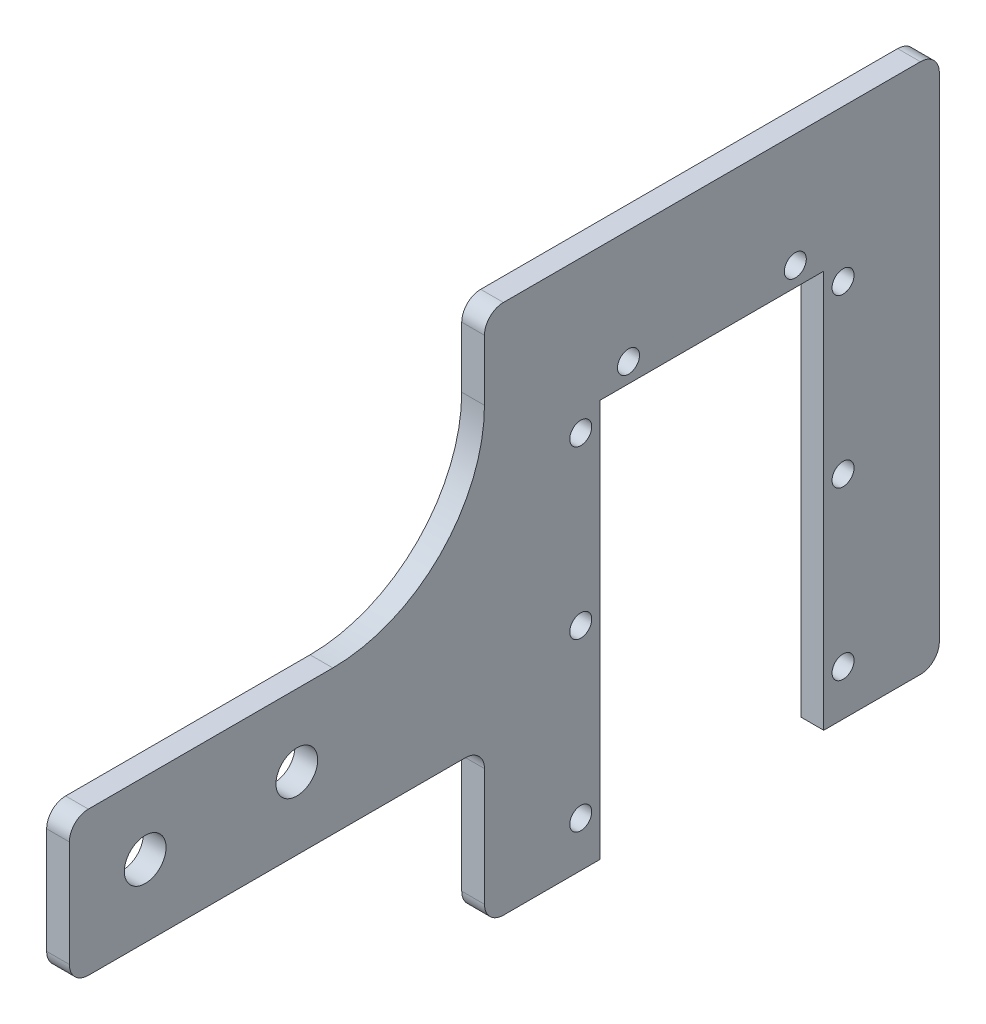
from build123d import *

# Parameters (mm, degrees)
BOSS_EXTRUDE2_DEPTH        = 1.5
SKETCH11_W                 = 70
SKETCH11_H                 = 19
BOSS_EXTRUDE3_DEPTH        = 1.5
M5_CLEARANCE_HOLE1_D       = 5.5
FILLET1_R                  = 2.5
FILLET2_R                  = 2.5
M2_5_CLEARANCE_HOLE1_D     = 2.9
M2_5_CLEARANCE_HOLE1_DEPTH = 3
FILLET3_R                  = 20


with BuildPart() as part:
    # Sketch8 → Boss-Extrude2 (new, symmetric)
    with BuildSketch(Plane(origin=(0, 0, 0), x_dir=(0, 0, -1), z_dir=(1, 0, 0))):
        Polygon((30, 60), (-30, 60), (-30, -10), (-14.75, -10), (-14.75, 42.45), (14.75, 42.45), (14.75, -10), (30, -10), align=None)
    extrude(amount=BOSS_EXTRUDE2_DEPTH, both=True)

    # Sketch11 → Boss-Extrude3 (add, symmetric)
    with BuildSketch(Plane(origin=(0, 0, 0), x_dir=(0, 0, -1), z_dir=(1, 0, 0))):
        with Locations((-49.75, 20)):
            Rectangle(SKETCH11_W, SKETCH11_H)
    extrude(amount=BOSS_EXTRUDE3_DEPTH, both=True)

    # M5 Clearance Hole1 (through all)
    with Locations(Plane(origin=(1.5, 0, 0), x_dir=(0, 0, -1), z_dir=(1, 0, 0))):
        with Locations((-74.75, 20), (-54.75, 20)):
            Hole(M5_CLEARANCE_HOLE1_D / 2)

    # Fillet1
    fillet1_edges = [part.edges().sort_by_distance(p)[0] for p in [
        (0, 10.5, 84.75),
        (0, 29.5, 84.75),
    ]]
    fillet(fillet1_edges, radius=FILLET1_R)

    # Fillet2
    fillet2_edges = [part.edges().sort_by_distance(p)[0] for p in [
        (0, -10, -30),
        (0, -10, 30),
        (0, 60, 30),
        (0, 60, -30),
        (0, 10.5, 30),
    ]]
    fillet(fillet2_edges, radius=FILLET2_R)

    # M2.5 Clearance Hole1
    with Locations(Plane(origin=(1.5, 0, 0), x_dir=(0, 0, -1), z_dir=(1, 0, 0))):
        with Locations((17.3, 40), (79.72833177, 74.743551237), (17.3, 18), (17.3, -4), (-17.3, -4), (-17.3, 18), (-17.3, 40), (-11, 45), (11, 45)):
            Hole(M2_5_CLEARANCE_HOLE1_D / 2, depth=M2_5_CLEARANCE_HOLE1_DEPTH)

    # Fillet3
    fillet3_edges = [part.edges().sort_by_distance(p)[0] for p in [
        (0, 29.5, 30),
    ]]
    fillet(fillet3_edges, radius=FILLET3_R)


solid = part.part
